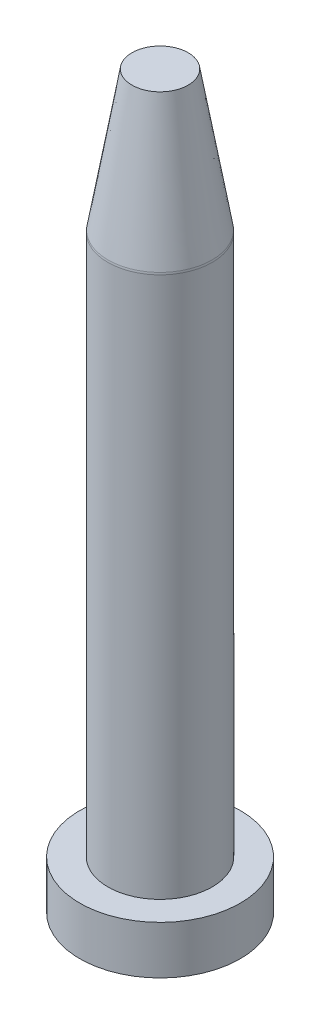
from build123d import *

# Parameters (mm, degrees)
FILLET_1_R = 3


with BuildPart() as part:
    # 草图1 → Revolve 333 (revolve)
    with BuildSketch(Plane.XY, mode=Mode.PRIVATE) as revolve_333_sk:
        Polygon((0, 0), (20, 0), (20, 12), (13, 12), (13, 147), (7, 182), (0, 182), align=None)
    revolve(revolve_333_sk.sketch.rotate(Axis((0, 0, 0), (0, 1, 0)), 90), axis=Axis((0, 0, 0), (0, 1, 0)))

    # 圆角1
    fillet_1_edges = [part.edges().sort_by_distance(p)[0] for p in [
        (0, 147, 13),
    ]]
    fillet(fillet_1_edges, radius=FILLET_1_R)


solid = part.part
